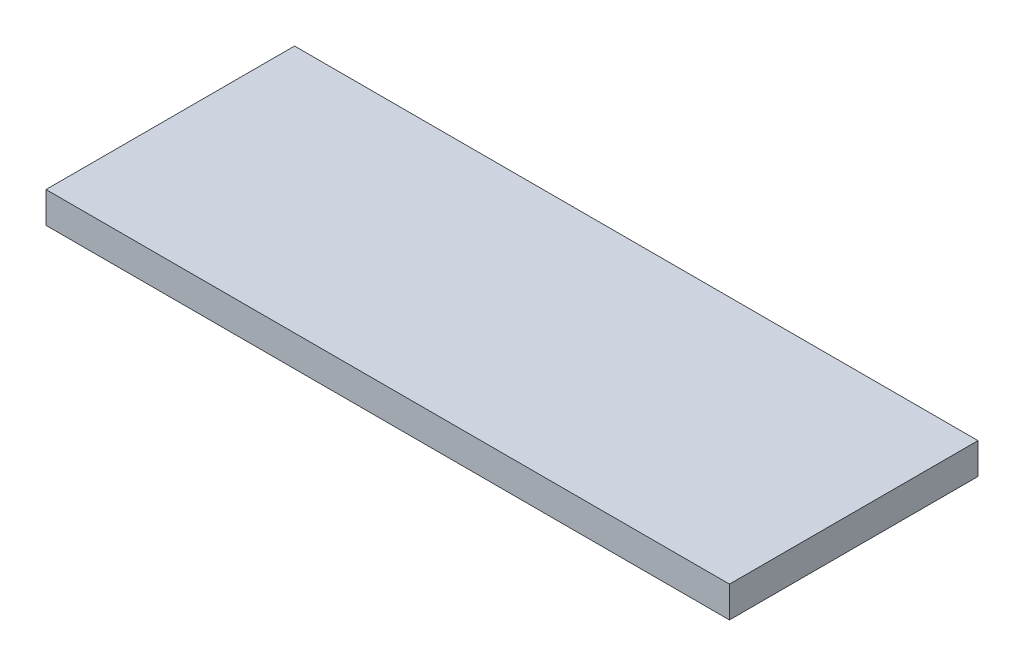
from build123d import *

# Parameters (mm, degrees)
SKETCH_1_W      = 44
SKETCH_1_H      = 16
EXTRUDE_1_DEPTH = 2


with BuildPart() as part:
    # 草图1 → 凸台-拉伸1 (new body)
    with BuildSketch(Plane(origin=(0, 0, 0), x_dir=(1, 0, 0), z_dir=(0, 1, 0))):
        Rectangle(SKETCH_1_W, SKETCH_1_H)
    extrude(amount=EXTRUDE_1_DEPTH)


solid = part.part
